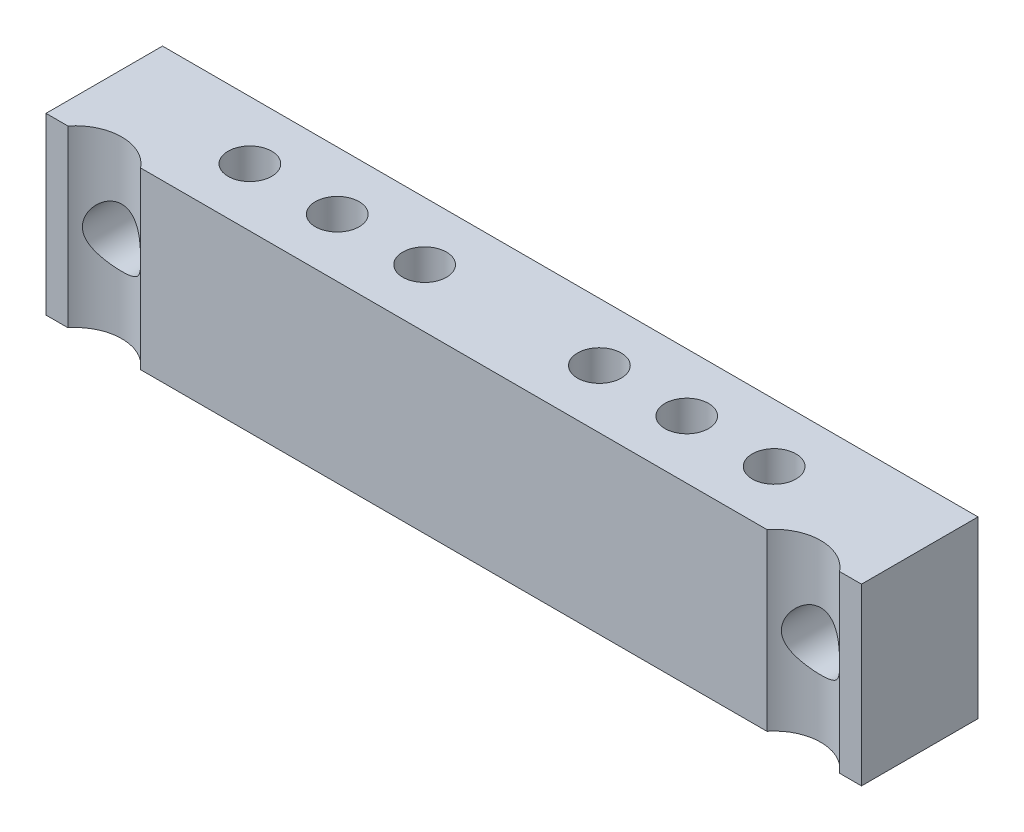
from build123d import *

# Parameters (mm, degrees)
CROQUIS1_W              = 28
CROQUIS1_H              = 6
CROQUIS1_R              = 1
SALIENTE_EXTRUIR1_DEPTH = 4
CROQUIS2_R              = 1.6
CROQUIS2_R_2            = 0.75
CORTAR_EXTRUIR1_DEPTH   = 6


with BuildPart() as part:
    # Croquis1 → Saliente-Extruir1 (new body)
    with BuildSketch(Plane.XY):
        with Locations((14, 3)):
            Rectangle(CROQUIS1_W, CROQUIS1_H)
        with Locations((2, 3)):
            Circle(CROQUIS1_R, mode=Mode.SUBTRACT)
        with Locations(Location((26, 3, 0), (0, 0, 180))):
            Circle(CROQUIS1_R, mode=Mode.SUBTRACT)
    extrude(amount=SALIENTE_EXTRUIR1_DEPTH)

    # Croquis2 → Cortar-Extruir1 (cut)
    with BuildSketch(Plane.XZ):
        with Locations((2, 5)):
            Circle(CROQUIS2_R)
        with Locations(Location((11, 2, 0), (0, 0, 270))):
            Circle(CROQUIS2_R_2)
        with Locations(Location((8, 2, 0), (0, 0, 270))):
            Circle(CROQUIS2_R_2)
        with Locations(Location((5, 2, 0), (0, 0, 270))):
            Circle(CROQUIS2_R_2)
        with Locations(Location((23, 2, 0), (0, 0, 90))):
            Circle(CROQUIS2_R_2)
        with Locations(Location((20, 2, 0), (0, 0, 90))):
            Circle(CROQUIS2_R_2)
        with Locations(Location((17, 2, 0), (0, 0, 90))):
            Circle(CROQUIS2_R_2)
        with Locations((26, 5)):
            Circle(CROQUIS2_R)
    extrude(amount=-CORTAR_EXTRUIR1_DEPTH, mode=Mode.SUBTRACT)


solid = part.part
